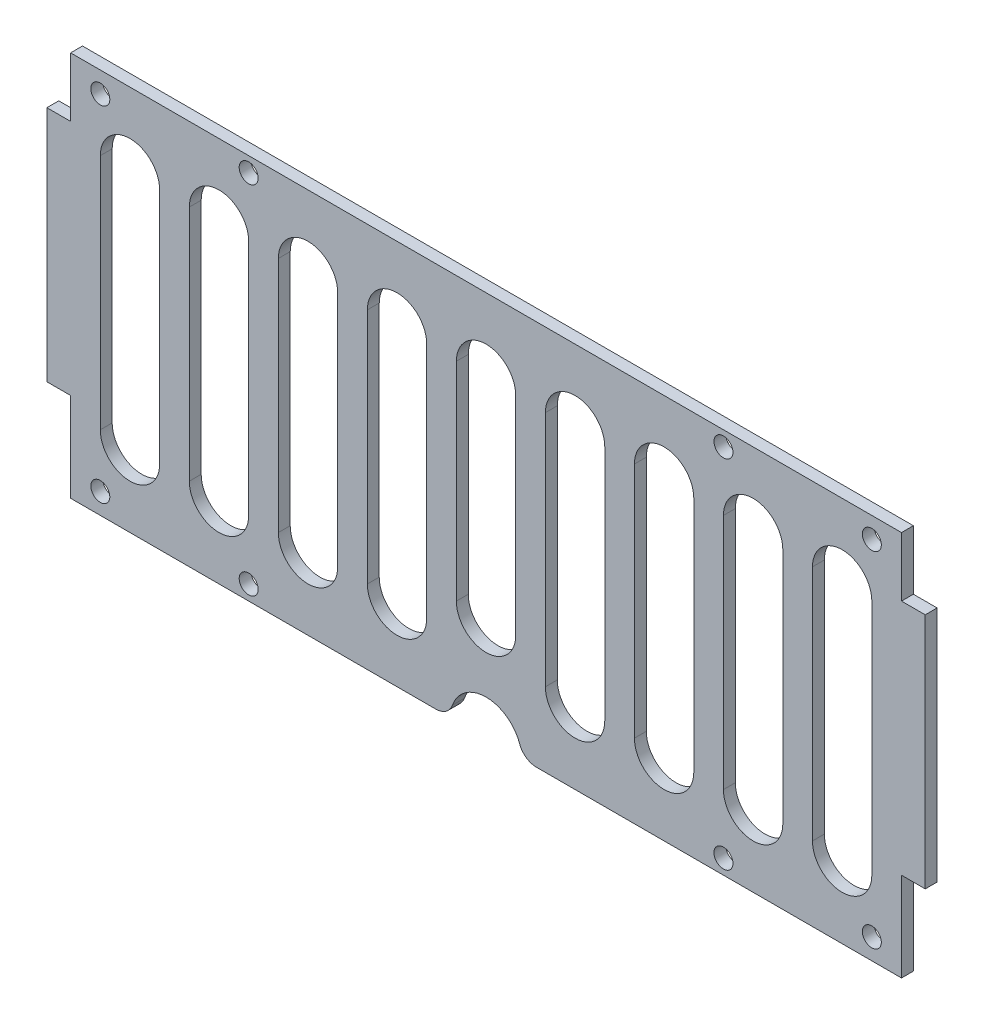
from build123d import *

# Parameters (mm, degrees)
SKETCH_1_W          = 140
SKETCH_1_H          = 65
EXTRUDE_1_DEPTH     = 2
SKETCH_2_W          = 4
SKETCH_2_H          = 40
EXTRUDE_2_DEPTH     = 2
CUT_EXTRUDE_1_DEPTH = 2
SKETCH_4_R          = 1.6
CUT_EXTRUDE_2_DEPTH = 2
SKETCH_5_R          = 1.6
CUT_EXTRUDE_3_DEPTH = 2
CUT_EXTRUDE_4_DEPTH = 81.847077869
FILLET_1_R          = 3
EXTRUDE_3_DEPTH     = 2


with BuildPart() as part:
    # 草图1 → 凸台-拉伸1 (new body)
    with BuildSketch(Plane.XY):
        Rectangle(SKETCH_1_W, SKETCH_1_H)
    extrude(amount=EXTRUDE_1_DEPTH)

    # 草图2 → 凸台-拉伸2 (add)
    with BuildSketch(Plane.XY.offset(2)):
        with Locations((-72, 2.5)):
            Rectangle(SKETCH_2_W, SKETCH_2_H)
        with Locations((72, 2.5)):
            Rectangle(SKETCH_2_W, SKETCH_2_H)
    extrude(amount=-EXTRUDE_2_DEPTH)

    # 草图3 → 切除-拉伸1 (cut)
    with BuildSketch(Plane.XY.offset(2)):
        with BuildLine():
            Line((-65, -20), (-65, 20))
            ThreePointArc((-65, 20), (-60, 25), (-55, 20))
            Line((-55, 20), (-55, -20))
            ThreePointArc((-55, -20), (-60, -25), (-65, -20))
        make_face()
        with BuildLine():
            Line((-50, -20), (-50, 20))
            ThreePointArc((-50, 20), (-45, 25), (-40, 20))
            Line((-40, 20), (-40, -20))
            ThreePointArc((-40, -20), (-45, -25), (-50, -20))
        make_face()
        with BuildLine():
            Line((-35, -20), (-35, 20))
            ThreePointArc((-35, 20), (-30, 25), (-25, 20))
            Line((-25, 20), (-25, -20))
            ThreePointArc((-25, -20), (-30, -25), (-35, -20))
        make_face()
        with BuildLine():
            Line((-20, -20), (-20, 20))
            ThreePointArc((-20, 20), (-15, 25), (-10, 20))
            Line((-10, 20), (-10, -20))
            ThreePointArc((-10, -20), (-15, -25), (-20, -20))
        make_face()
        with BuildLine():
            Line((-5, -20), (-5, 20))
            ThreePointArc((-5, 20), (0, 25), (5, 20))
            Line((5, 20), (5, -20))
            ThreePointArc((5, -20), (0, -25), (-5, -20))
        make_face()
        with BuildLine():
            Line((10, -20), (10, 20))
            ThreePointArc((10, 20), (15, 25), (20, 20))
            Line((20, 20), (20, -20))
            ThreePointArc((20, -20), (15, -25), (10, -20))
        make_face()
        with BuildLine():
            Line((25, -20), (25, 20))
            ThreePointArc((25, 20), (30, 25), (35, 20))
            Line((35, 20), (35, -20))
            ThreePointArc((35, -20), (30, -25), (25, -20))
        make_face()
        with BuildLine():
            Line((40, -20), (40, 20))
            ThreePointArc((40, 20), (45, 25), (50, 20))
            Line((50, 20), (50, -20))
            ThreePointArc((50, -20), (45, -25), (40, -20))
        make_face()
        with BuildLine():
            Line((55, -20), (55, 20))
            ThreePointArc((55, 20), (60, 25), (65, 20))
            Line((65, 20), (65, -20))
            ThreePointArc((65, -20), (60, -25), (55, -20))
        make_face()
    extrude(amount=-CUT_EXTRUDE_1_DEPTH, mode=Mode.SUBTRACT)

    # 草图4 → 切除-拉伸2 (cut)
    with BuildSketch(Plane(origin=(0, 0, 0), x_dir=(-1, 0, 0), z_dir=(0, 0, -1))):
        with Locations((-40, -30)):
            Circle(SKETCH_4_R)
        with Locations(Location((40, -30, 0), (0, 0, 180))):
            Circle(SKETCH_4_R)
        with Locations((40, 30)):
            Circle(SKETCH_4_R)
        with Locations(Location((-40, 30, 0), (0, 0, 180))):
            Circle(SKETCH_4_R)
    extrude(amount=-CUT_EXTRUDE_2_DEPTH, mode=Mode.SUBTRACT)

    # 草图5 → 切除-拉伸3 (cut)
    with BuildSketch(Plane(origin=(0, 0, 0), x_dir=(-1, 0, 0), z_dir=(0, 0, -1))):
        with Locations((-65, -29)):
            Circle(SKETCH_5_R)
        with Locations(Location((-65, 29, 0), (0, 0, 180))):
            Circle(SKETCH_5_R)
        with Locations(Location((65, -29, 0), (0, 0, 180))):
            Circle(SKETCH_5_R)
        with Locations((65, 29)):
            Circle(SKETCH_5_R)
    extrude(amount=-CUT_EXTRUDE_3_DEPTH, mode=Mode.SUBTRACT)

    # 草图6 → 切除-拉伸4 (cut, through all)
    with BuildSketch(Plane(origin=(0, 0, 0), x_dir=(-1, 0, 0), z_dir=(0, 0, -1))):
        with BuildLine():
            Line((-6, -32.5), (6, -32.5))
            ThreePointArc((6, -32.5), (0, -26.5), (-6, -32.5))
        make_face()
    extrude(amount=-CUT_EXTRUDE_4_DEPTH, mode=Mode.SUBTRACT)

    # 圆角1
    fillet_1_edges = [part.edges().sort_by_distance(p)[0] for p in [
        (6, -32.5, 1),
        (-6, -32.5, 1),
    ]]
    fillet(fillet_1_edges, radius=FILLET_1_R)

    # 草图7 → 凸台-拉伸3 (add, through all)
    with BuildSketch(Plane(origin=(0, 0, 0), x_dir=(-1, 0, 0), z_dir=(0, 0, -1))):
        with BuildLine():
            Line((5, -15), (5, -20))
            ThreePointArc((5, -20), (0, -25), (-5, -20))
            Line((-5, -20), (-5, -15))
            ThreePointArc((-5, -15), (0, -20), (5, -15))
        make_face()
    extrude(amount=-EXTRUDE_3_DEPTH)


solid = part.part
